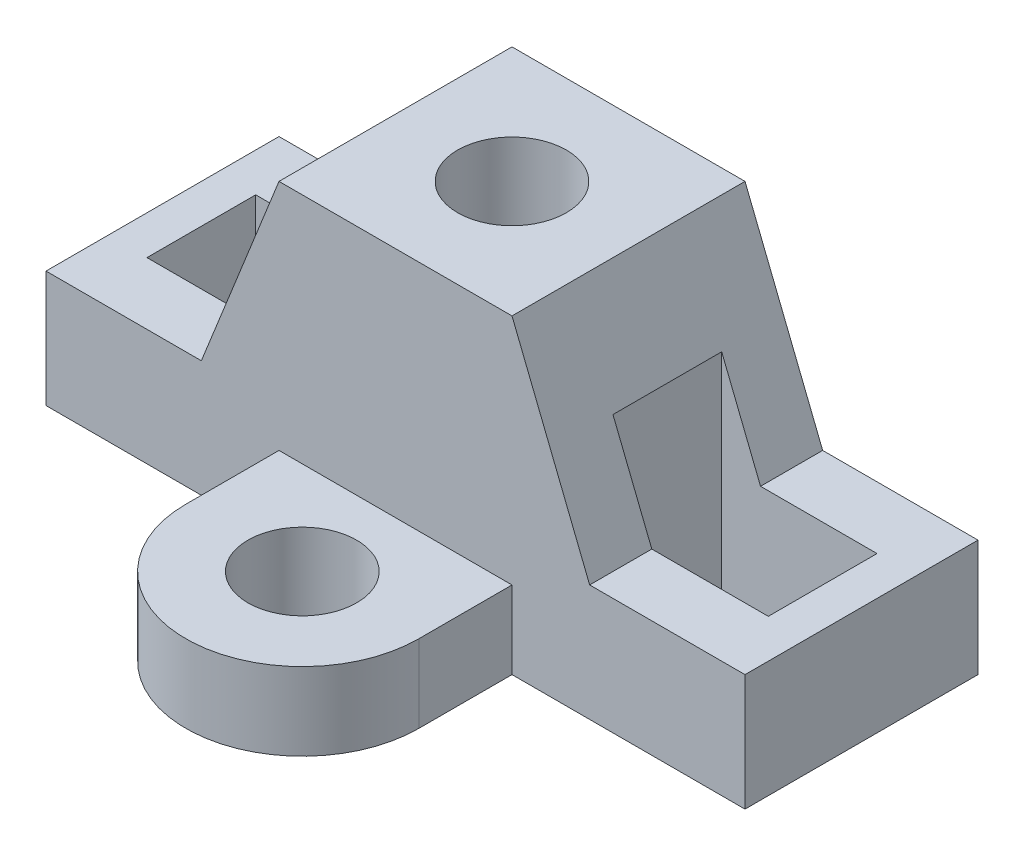
from build123d import *

# Parameters (mm, degrees)
BOSS_EXTRUDE1_DEPTH     = 30
CUT_EXTRUDE1_DEPTH      = 68.268120235
CUT_EXTRUDE1_DEPTH_BACK = 68.268120235
SKETCH3_W               = 20
SKETCH3_H               = 14
CUT_EXTRUDE2_DEPTH      = 68.268120235
CUT_EXTRUDE2_DEPTH_BACK = 68.268120235
SKETCH4_R               = 7
SKETCH5_R               = 7
BOSS_EXTRUDE3_DEPTH     = 10


with BuildPart() as part:
    # Sketch2 → Boss-Extrude1 (new body)
    with BuildSketch(Plane.XY):
        Polygon((-45, 0), (45, 0), (45, 15), (25, 15), (15, 40), (-15, 40), (-25, 15), (-45, 15), align=None)
    extrude(amount=-BOSS_EXTRUDE1_DEPTH)

    # Sketch3 → Cut-Extrude1 (cut, two sides: drawn at the far end of the back side and taken through both)
    with BuildSketch(Plane(origin=(0, 0, 0), x_dir=(1, 0, 0), z_dir=(0, 1, 0)).offset(-CUT_EXTRUDE1_DEPTH_BACK)):
        with Locations((-30, 15)):
            Rectangle(SKETCH3_W, SKETCH3_H)
        with Locations((30, 15)):
            Rectangle(SKETCH3_W, SKETCH3_H)
    extrude(amount=CUT_EXTRUDE1_DEPTH + CUT_EXTRUDE1_DEPTH_BACK, mode=Mode.SUBTRACT)

    # Sketch4 → Cut-Extrude2 (cut, two sides: drawn at the far end of the back side and taken through both)
    with BuildSketch(Plane(origin=(0, 0, 0), x_dir=(1, 0, 0), z_dir=(0, 1, 0)).offset(-CUT_EXTRUDE2_DEPTH_BACK)):
        with Locations(Location((0, 15, 0), (0, 0, 90))):
            Circle(SKETCH4_R)
    extrude(amount=CUT_EXTRUDE2_DEPTH + CUT_EXTRUDE2_DEPTH_BACK, mode=Mode.SUBTRACT)

    # Sketch5 → Boss-Extrude3 (add)
    with BuildSketch(Plane(origin=(0, 0, 0), x_dir=(1, 0, 0), z_dir=(0, 1, 0))):
        with BuildLine():
            Line((-15, 0), (-15, -12))
            ThreePointArc((-15, -12), (0, -27), (15, -12))
            Line((15, -12), (15, 0))
            Line((15, 0), (-15, 0))
        make_face()
        with Locations(Location((0, -12, 0), (0, 0, 270))):
            Circle(SKETCH5_R, mode=Mode.SUBTRACT)
    extrude(amount=BOSS_EXTRUDE3_DEPTH)


solid = part.part
